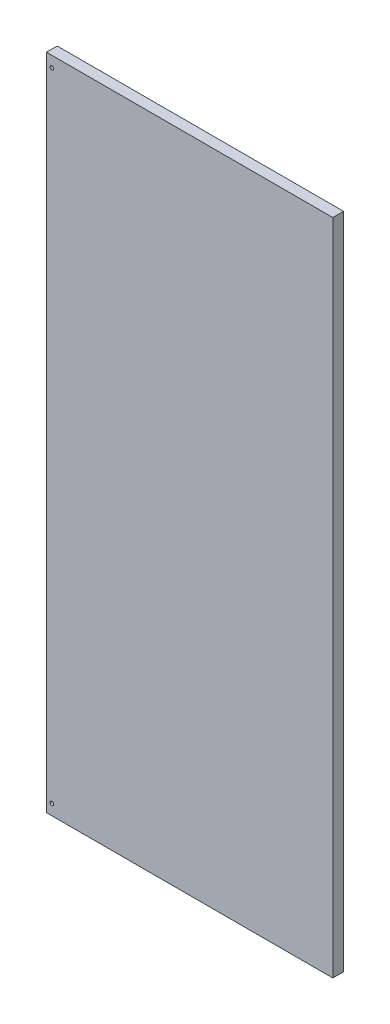
from build123d import *

# Parameters (mm, degrees)
CROQUIS1_W              = 400
CROQUIS1_H              = 920
SALIENTE_EXTRUIR1_DEPTH = 15
CROQUIS3_R              = 2.5
CORTAR_EXTRUIR1_DEPTH   = 972.170318383


with BuildPart() as part:
    # Croquis1 → Saliente-Extruir1 (new body)
    with BuildSketch(Plane.XY):
        with Locations((-178.839285714, -434.107142857)):
            Rectangle(CROQUIS1_W, CROQUIS1_H)
    extrude(amount=-SALIENTE_EXTRUIR1_DEPTH)

    # Croquis3 → Cortar-Extruir1 (cut, through all)
    with BuildSketch(Plane.XY):
        with Locations((-371.339285714, 10.892857143)):
            Circle(CROQUIS3_R)
        with Locations(Location((-371.339285714, -879.107142857, 0), (0, 0, 180))):
            Circle(CROQUIS3_R)
    extrude(amount=-CORTAR_EXTRUIR1_DEPTH, mode=Mode.SUBTRACT)


solid = part.part
